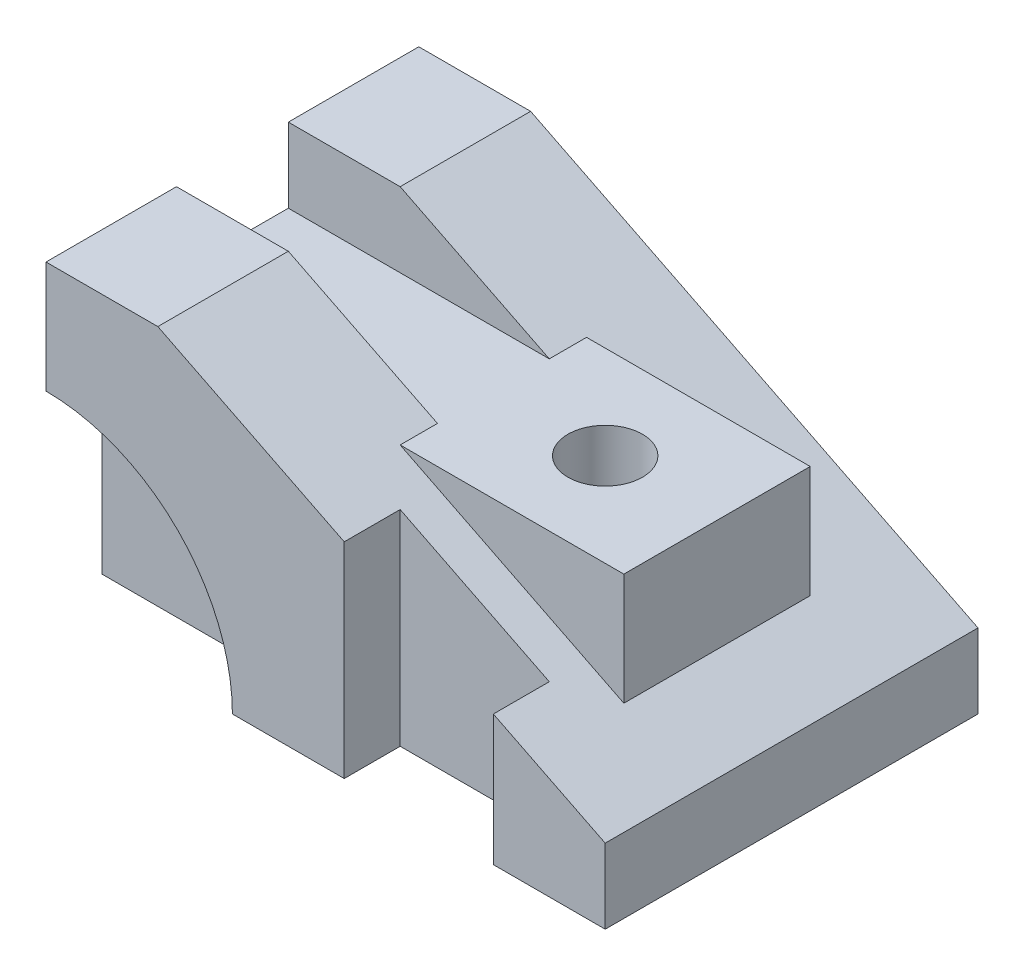
from build123d import *

# Parameters (mm, degrees)
BOSS_EXTRUDE1_DEPTH      = 50
BOSS_EXTRUDE1_DEPTH_BACK = 50
SKETCH2_R                = 50
CUT_EXTRUDE1_DEPTH       = 15
BOSS_EXTRUDE2_DEPTH      = 25
BOSS_EXTRUDE2_DEPTH_BACK = 25
SKETCH4_R                = 10
CUT_EXTRUDE2_DEPTH       = 170.115345253
SKETCH5_W                = 133.233109364
SKETCH5_H                = 30
CUT_EXTRUDE3_DEPTH       = 20
SKETCH7_W                = 40
SKETCH7_H                = 80.772964502
CUT_EXTRUDE4_DEPTH       = 15


with BuildPart() as part:
    # Sketch1 → Boss-Extrude1 (new, two sides: drawn at the far end of the back side and taken through both)
    with BuildSketch(Plane.XY.offset(-BOSS_EXTRUDE1_DEPTH_BACK)):
        Polygon((0, 0), (150, 0), (150, 20), (30, 80), (0, 80), align=None)
    extrude(amount=BOSS_EXTRUDE1_DEPTH + BOSS_EXTRUDE1_DEPTH_BACK)

    # Sketch2 → Cut-Extrude1 (cut)
    with BuildSketch(Plane.XY.offset(50)):
        Circle(SKETCH2_R)
    extrude(amount=-CUT_EXTRUDE1_DEPTH, mode=Mode.SUBTRACT)

    # Sketch3 → Boss-Extrude2 (add, two sides: drawn at the far end of the back side and taken through both)
    with BuildSketch(Plane.XY.offset(-BOSS_EXTRUDE2_DEPTH_BACK)):
        Polygon((70, 60), (130, 60), (130, 30), align=None)
    extrude(amount=BOSS_EXTRUDE2_DEPTH + BOSS_EXTRUDE2_DEPTH_BACK)

    # Sketch4 → Cut-Extrude2 (cut, through all)
    with BuildSketch(Plane(origin=(0, 60, 0), x_dir=(1, 0, 0), z_dir=(0, 1, 0))):
        with Locations((100, 0)):
            Circle(SKETCH4_R)
    extrude(amount=-CUT_EXTRUDE2_DEPTH, mode=Mode.SUBTRACT)

    # Sketch5 → Cut-Extrude3 (cut)
    with BuildSketch(Plane(origin=(0, 80, 0), x_dir=(1, 0, 0), z_dir=(0, 1, 0))):
        with Locations((16.458179219, 0)):
            Rectangle(SKETCH5_W, SKETCH5_H)
    extrude(amount=-CUT_EXTRUDE3_DEPTH, mode=Mode.SUBTRACT)

    # Sketch7 → Cut-Extrude4 (cut)
    with BuildSketch(Plane.XY.offset(50)):
        with Locations((100, 40.386482251)):
            Rectangle(SKETCH7_W, SKETCH7_H)
    extrude(amount=-CUT_EXTRUDE4_DEPTH, mode=Mode.SUBTRACT)


solid = part.part
